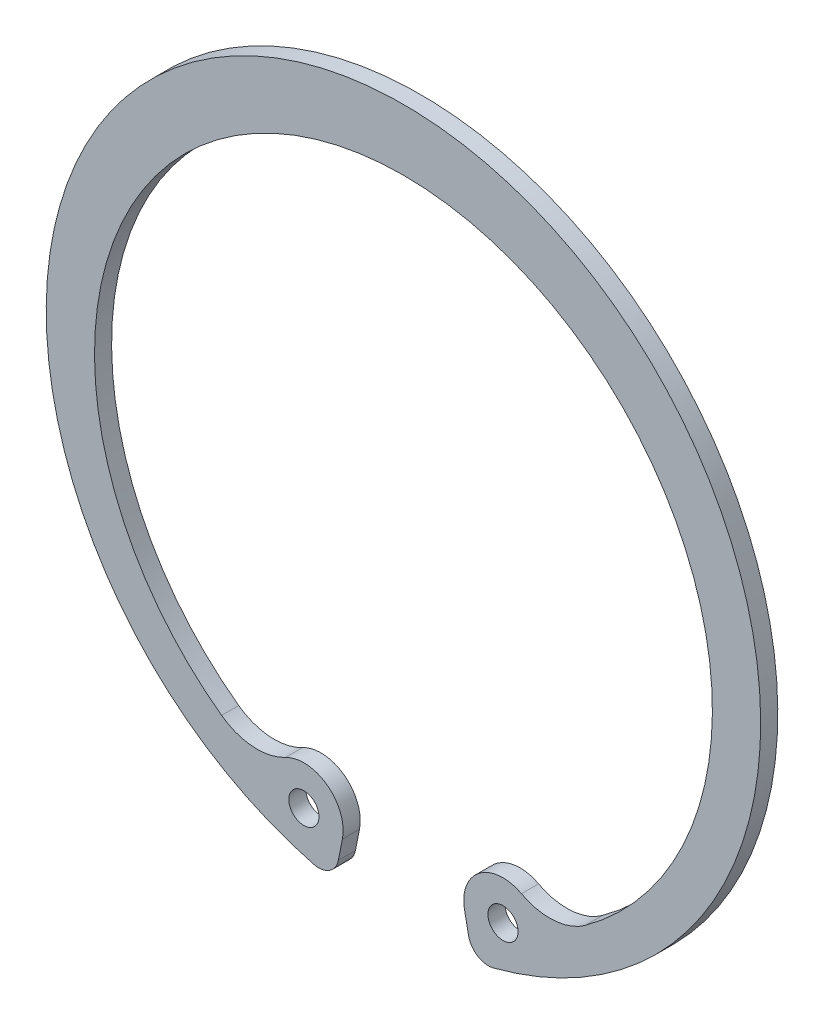
from build123d import *

# Parameters (mm, degrees)
SKETCH_3_R      = 1.5
EXTRUDE_1_DEPTH = 1.7


with BuildPart() as part:
    # Эскиз3 → Бобышка-Вытянуть1 (new body)
    with BuildSketch(Plane.XY):
        with BuildLine():
            Line((-6.473729419, -32.810303411), (-6.068906589, -30.772625658))
            ThreePointArc((-6.068906589, -30.772625658), (-7.567661229, -26.882580179), (-11.724624303, -26.568928632))
            ThreePointArc((-11.724624303, -26.568928632), (-14.962869732, -27.255997351), (-18.072620871, -26.12120894))
            ThreePointArc((-18.072620871, -26.12120894), (0, 29.4), (18.072620871, -26.12120894))
            ThreePointArc((18.072620871, -26.12120894), (14.962869732, -27.255997351), (11.724624303, -26.568928632))
            ThreePointArc((11.724624303, -26.568928632), (7.567661229, -26.882580179), (6.068906589, -30.772625658))
            Line((6.068906589, -30.772625658), (6.473729419, -32.810303411))
            ThreePointArc((6.473729419, -32.810303411), (7.37290154, -34.115019127), (8.938996834, -34.356139707))
            ThreePointArc((8.938996834, -34.356139707), (0, 35.5), (-8.938996834, -34.356139707))
            ThreePointArc((-8.938996834, -34.356139707), (-7.37290154, -34.115019127), (-6.473729419, -32.810303411))
        make_face()
        with Locations((-9.89414741, -30.012669962)):
            Circle(SKETCH_3_R, mode=Mode.SUBTRACT)
        with Locations(Location((9.89414741, -30.012669962, 0), (0, 0, 180))):
            Circle(SKETCH_3_R, mode=Mode.SUBTRACT)
    extrude(amount=EXTRUDE_1_DEPTH)


solid = part.part
